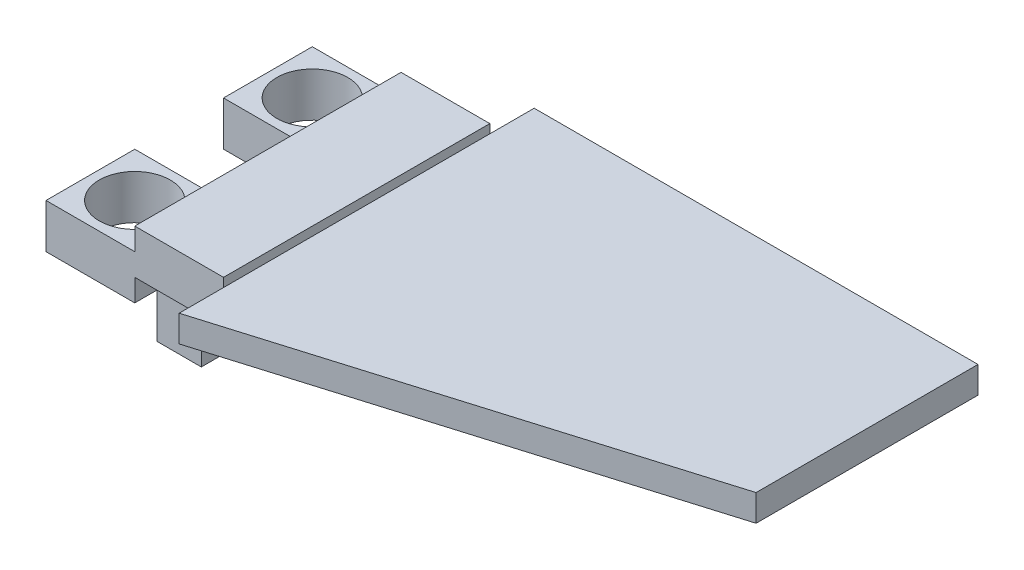
from build123d import *

# Parameters (mm, degrees)
SKETCH1_W             = 10
SKETCH1_H             = 10
SKETCH1_R             = 4
BOSS_EXTRUDE1_DEPTH   = 5
BOSS_EXTRUDE1_2_DEPTH = 5
SKETCH2_W             = 5
SKETCH2_H             = 10
BOSS_EXTRUDE2_DEPTH   = 5
SKETCH4_W             = 10
SKETCH4_H             = 30
BOSS_EXTRUDE4_DEPTH   = 2.5
BOSS_EXTRUDE7_DEPTH   = 1.5


with BuildPart() as part:
    # Sketch1 → Boss-Extrude1 (new body)
    with BuildSketch(Plane(origin=(0, 0, 0), x_dir=(1, 0, 0), z_dir=(0, 1, 0))):
        with Locations((5, 0)):
            Rectangle(SKETCH1_W, SKETCH1_H)
        with Locations(Location((5, 0, 0), (0, 0, 270))):
            Circle(SKETCH1_R, mode=Mode.SUBTRACT)
    extrude(amount=BOSS_EXTRUDE1_DEPTH)

    # Sketch2 → Boss-Extrude2 (add)
    with BuildSketch(Plane(origin=(10, 0, 0), x_dir=(0, 0, -1), z_dir=(1, 0, 0))):
        Rectangle(SKETCH2_W, SKETCH2_H)
        with Locations((20, 0)):
            Rectangle(SKETCH2_W, SKETCH2_H)
    extrude(amount=BOSS_EXTRUDE2_DEPTH)


with BuildPart() as body_2:
    # Sketch1 → Boss-Extrude1 2 (new body)
    with BuildSketch(Plane(origin=(0, 0, 0), x_dir=(1, 0, 0), z_dir=(0, 1, 0))):
        with Locations((5, 20)):
            Rectangle(SKETCH1_W, SKETCH1_H)
        with Locations(Location((5, 20, 0), (0, 0, 90))):
            Circle(SKETCH1_R, mode=Mode.SUBTRACT)
    extrude(amount=BOSS_EXTRUDE1_2_DEPTH)



with BuildPart() as boss_extrude2_piece_1:
    # of the separate pieces the step leaves, piece 1, a body of its own (boss_extrude2_pieces)
    add(part.part.solids().sort_by_distance((0, 0, -5))[0])

    # Sketch4 → Boss-Extrude4 (add, symmetric)
    with BuildSketch(Plane(origin=(0, 5, 0), x_dir=(1, 0, 0), z_dir=(0, 1, 0))):
        with Locations((15, 10)):
            Rectangle(SKETCH4_W, SKETCH4_H)
    extrude(amount=BOSS_EXTRUDE4_DEPTH, both=True)


with BuildPart() as boss_extrude2_piece_2:
    # of the separate pieces the step leaves, piece 2, a body of its own (boss_extrude2_pieces)
    add(part.part.solids().sort_by_distance((10, -5, -17.5))[0])


with BuildPart() as body_2_1:
    add(body_2.part)

    add(boss_extrude2_piece_1.part)  # Boss-Extrude7 merges Boss-Extrude2 piece 1

    add(boss_extrude2_piece_2.part)  # Boss-Extrude7 merges Boss-Extrude2 piece 2
    # Sketch8 → Boss-Extrude7 (add, symmetric)
    with BuildSketch(Plane(origin=(0, 5, 0), x_dir=(1, 0, 0), z_dir=(0, 1, 0))):
        Polygon((20, 25), (20, 30), (70, 30), (70, 5), (20, -10), (20, -5), (10, -5), (10, 25), align=None)
    extrude(amount=BOSS_EXTRUDE7_DEPTH, both=True)


solid = body_2_1.part
